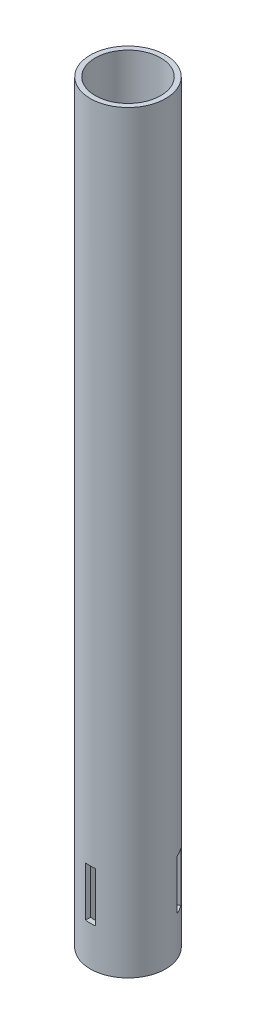
from build123d import *

# Parameters (mm, degrees)
SKETCH1_R           = 3.8
SKETCH1_R_2         = 3.3
BOSS_EXTRUDE2_DEPTH = 76
SKETCH2_W           = 1
SKETCH2_H           = 5
CUT_EXTRUDE4_DEPTH  = 8
CIRPATTERN1_COUNT   = 3


with BuildPart() as part:
    # Sketch1 → Boss-Extrude2 (new body)
    with BuildSketch(Plane(origin=(0, 0, 0), x_dir=(1, 0, 0), z_dir=(0, 1, 0))):
        with Locations(Location((0, 0, 0), (0, 0, 270))):
            Circle(SKETCH1_R)
        with Locations(Location((0, 0, 0), (0, 0, 270))):
            Circle(SKETCH1_R_2, mode=Mode.SUBTRACT)
    extrude(amount=BOSS_EXTRUDE2_DEPTH)

    # Sketch2 → Cut-Extrude4 (cut)
    with BuildSketch(Plane.XY):
        with Locations((0, 6.5)):
            Rectangle(SKETCH2_W, SKETCH2_H)
    cut_extrude4 = extrude(amount=CUT_EXTRUDE4_DEPTH, mode=Mode.SUBTRACT)

    # CirPattern1: Cut-Extrude4 ×3 about axis
    cirpattern1_axis = Axis((0, 0, 0), (0, 1, 0))
    for i in range(1, CIRPATTERN1_COUNT):
        add(cut_extrude4.rotate(cirpattern1_axis, i * 360 / CIRPATTERN1_COUNT), mode=Mode.SUBTRACT)


solid = part.part
